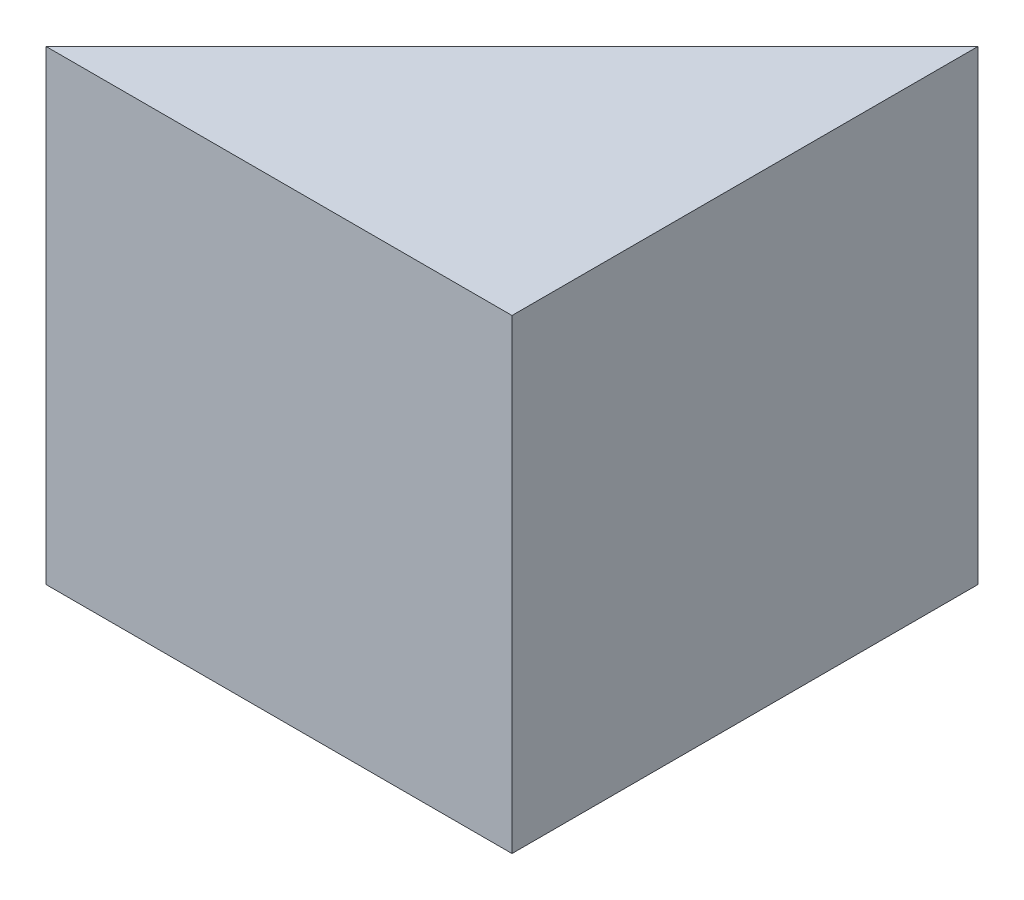
from build123d import *

# Parameters (mm, degrees)
SKETCH1_W               = 1
SKETCH1_H               = 1
BOSS_EXTRUDE1_DEPTH     = 1
CUT_EXTRUDE1_DEPTH      = 2.732050808
CUT_EXTRUDE1_DEPTH_BACK = 0.5


with BuildPart() as part:
    # Sketch1 → Boss-Extrude1 (new body)
    with BuildSketch(Plane(origin=(0, 0, 0), x_dir=(1, 0, 0), z_dir=(0, 1, 0))):
        with Locations((0.5, 0.5)):
            Rectangle(SKETCH1_W, SKETCH1_H)
    extrude(amount=BOSS_EXTRUDE1_DEPTH)

    # Sketch3 → Cut-Extrude1 (cut, two sides: drawn at the far end of the back side and taken through both)
    with BuildSketch(Plane(origin=(0, 1, 0), x_dir=(1, 0, 0), z_dir=(0, 1, 0)).offset(-CUT_EXTRUDE1_DEPTH_BACK)):
        Polygon((-9.071067812, -9.071067812), (0, 0), (1, 1), (10.071067812, 10.071067812), (-8.071067812, 28.213203436), (-27.213203436, 9.071067812), align=None)
    extrude(amount=CUT_EXTRUDE1_DEPTH + CUT_EXTRUDE1_DEPTH_BACK, mode=Mode.SUBTRACT)


solid = part.part
